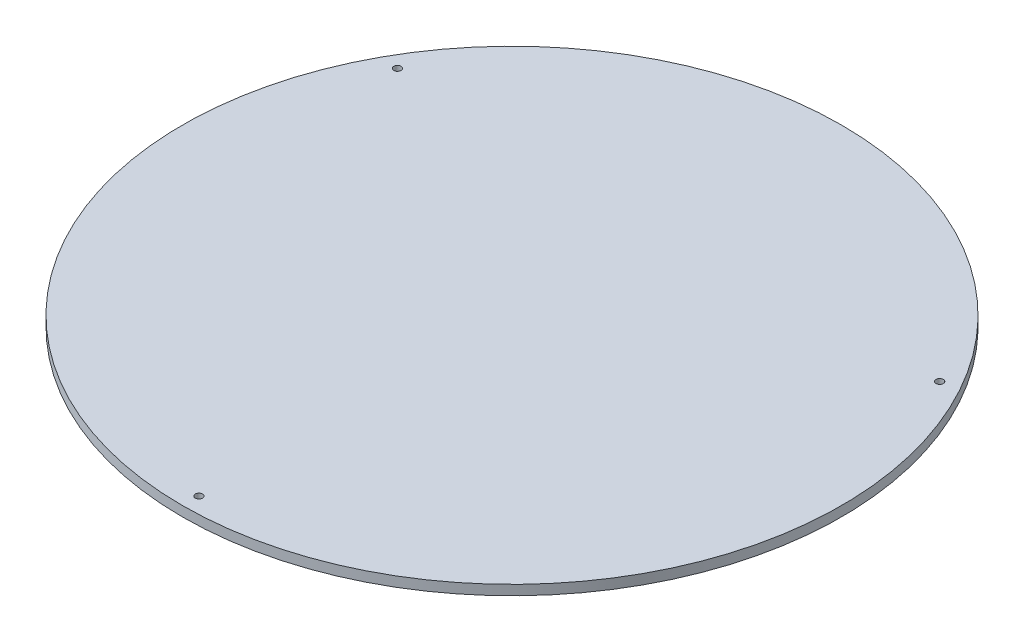
from build123d import *

# Parameters (mm, degrees)
SKETCH_1_R          = 100
EXTRUDE_1_DEPTH     = 3
CUT_EXTRUDE_1_REACH = 143.453
SKETCH_2_R          = 1.1


with BuildPart() as part:
    # 草图1 → 凸台-拉伸1 (new body)
    with BuildSketch(Plane(origin=(0, 0, 0), x_dir=(1, 0, 0), z_dir=(0, 1, 0))):
        with Locations(Location((0, 0, 0), (0, 0, 270))):
            Circle(SKETCH_1_R)
    extrude(amount=EXTRUDE_1_DEPTH)

    # 草图2 → 切除-拉伸1 (cut, up to next)
    with BuildSketch(Plane(origin=(0, 3, 0), x_dir=(1, 0, 0), z_dir=(0, 1, 0)), mode=Mode.PRIVATE) as cut_extrude_1_sk1:
        with Locations(Location((0, -95, 0), (0, 0, 270))):
            Circle(SKETCH_2_R)
    cut_extrude_1_tool1 = extrude(cut_extrude_1_sk1.sketch, amount=-CUT_EXTRUDE_1_REACH, mode=Mode.PRIVATE) & part.part
    # 草图2 → 切除-拉伸1 (cut, up to next)
    with BuildSketch(Plane(origin=(0, 3, 0), x_dir=(1, 0, 0), z_dir=(0, 1, 0)), mode=Mode.PRIVATE) as cut_extrude_1_sk2:
        with Locations(Location((-82.27241336, 47.5, 0), (0, 0, 270))):
            Circle(SKETCH_2_R)
    cut_extrude_1_tool2 = extrude(cut_extrude_1_sk2.sketch, amount=-CUT_EXTRUDE_1_REACH, mode=Mode.PRIVATE) & part.part
    # 草图2 → 切除-拉伸1 (cut, up to next)
    with BuildSketch(Plane(origin=(0, 3, 0), x_dir=(1, 0, 0), z_dir=(0, 1, 0)), mode=Mode.PRIVATE) as cut_extrude_1_sk3:
        with Locations(Location((82.27241336, 47.5, 0), (0, 0, 270))):
            Circle(SKETCH_2_R)
    cut_extrude_1_tool3 = extrude(cut_extrude_1_sk3.sketch, amount=-CUT_EXTRUDE_1_REACH, mode=Mode.PRIVATE) & part.part
    add(cut_extrude_1_tool1.solids().sort_by_distance((0, 3, 95))[0], mode=Mode.SUBTRACT)
    add(cut_extrude_1_tool2.solids().sort_by_distance((-82.272413, 3, -47.5))[0], mode=Mode.SUBTRACT)
    add(cut_extrude_1_tool3.solids().sort_by_distance((82.272413, 3, -47.5))[0], mode=Mode.SUBTRACT)


solid = part.part
